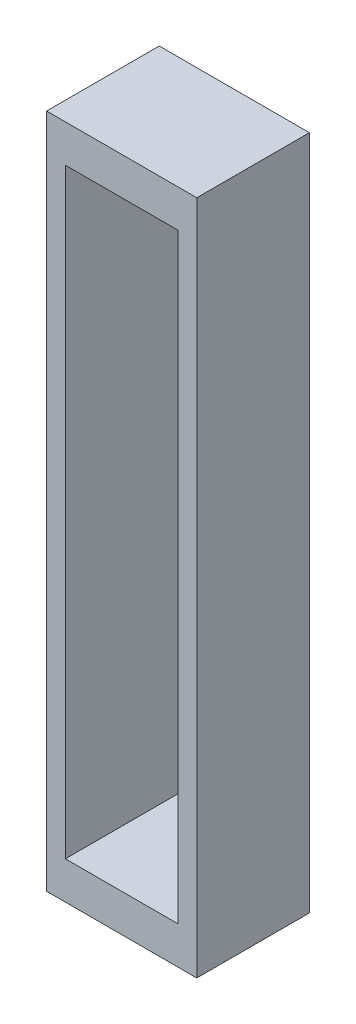
from build123d import *

# Parameters (mm, degrees)
SKETCH1_W           = 40
SKETCH1_H           = 180
BOSS_EXTRUDE1_DEPTH = 30
SKETCH2_W           = 30
SKETCH2_H           = 160
CUT_EXTRUDE1_DEPTH  = 30


with BuildPart() as part:
    # Sketch1 → Boss-Extrude1 (new body)
    with BuildSketch(Plane.XY):
        with Locations((0, 90)):
            Rectangle(SKETCH1_W, SKETCH1_H)
    extrude(amount=BOSS_EXTRUDE1_DEPTH)

    # Sketch2 → Cut-Extrude1 (cut)
    with BuildSketch(Plane.XY):
        with Locations((0, 90)):
            Rectangle(SKETCH2_W, SKETCH2_H)
    extrude(amount=CUT_EXTRUDE1_DEPTH, mode=Mode.SUBTRACT)


solid = part.part
